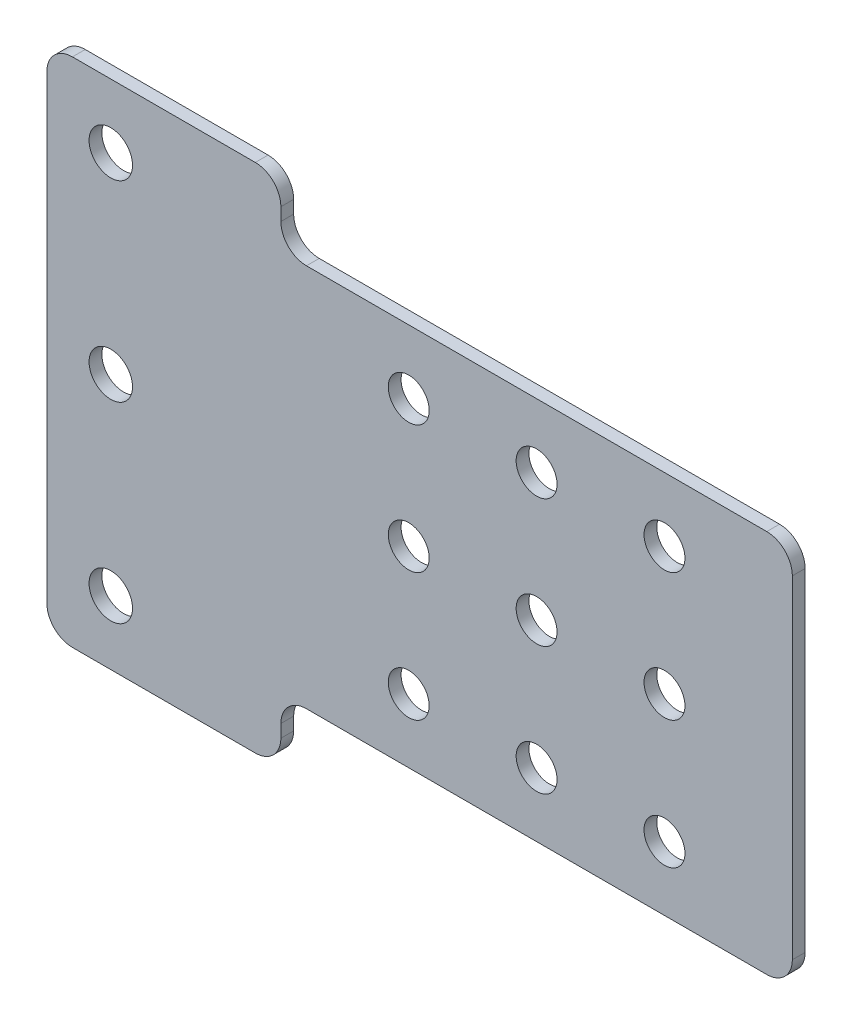
from build123d import *

# Parameters (mm, degrees)
SKETCH1_W           = 50.8
SKETCH1_H           = 38.1
SKETCH1_R           = 2.032
BOSS_EXTRUDE1_DEPTH = 1.27
FILLET3_R           = 2.54
SKETCH2_R           = 2.159
BOSS_EXTRUDE2_DEPTH = 1.27
FILLET6_R           = 2.54


with BuildPart() as part:
    # Sketch1 → Boss-Extrude1 (new body)
    with BuildSketch(Plane.XY):
        Rectangle(SKETCH1_W, SKETCH1_H)
        with Locations((-12.7, 12.7)):
            Circle(SKETCH1_R, mode=Mode.SUBTRACT)
        with Locations((0, 12.7)):
            Circle(SKETCH1_R, mode=Mode.SUBTRACT)
        with Locations((12.7, 12.7)):
            Circle(SKETCH1_R, mode=Mode.SUBTRACT)
        Circle(SKETCH1_R, mode=Mode.SUBTRACT)
        with Locations((12.7, 0)):
            Circle(SKETCH1_R, mode=Mode.SUBTRACT)
        with Locations((0, -12.7)):
            Circle(SKETCH1_R, mode=Mode.SUBTRACT)
        with Locations((12.7, -12.7)):
            Circle(SKETCH1_R, mode=Mode.SUBTRACT)
        with Locations((-12.7, 0)):
            Circle(SKETCH1_R, mode=Mode.SUBTRACT)
        with Locations((-12.7, -12.7)):
            Circle(SKETCH1_R, mode=Mode.SUBTRACT)
    extrude(amount=BOSS_EXTRUDE1_DEPTH)

    # Fillet3
    fillet3_edges = [part.edges().sort_by_distance(p)[0] for p in [
        (25.4, -19.05, 0.635),
        (25.4, 19.05, 0.635),
    ]]
    fillet(fillet3_edges, radius=FILLET3_R)

    # Sketch2 → Boss-Extrude2 (add)
    with BuildSketch(Plane.XY.offset(1.27)):
        Polygon((-25.4, -25.4), (-25.4, -19.05), (-25.4, 19.05), (-25.4, 25.4), (-48.641, 25.4), (-48.641, -25.4), align=None)
        with Locations((-42.291, -19.05)):
            Circle(SKETCH2_R, mode=Mode.SUBTRACT)
        with Locations((-42.291, 0)):
            Circle(SKETCH2_R, mode=Mode.SUBTRACT)
        with Locations((-42.291, 19.05)):
            Circle(SKETCH2_R, mode=Mode.SUBTRACT)
    extrude(amount=-BOSS_EXTRUDE2_DEPTH)

    # Fillet6
    fillet6_edges = [part.edges().sort_by_distance(p)[0] for p in [
        (-25.4, 25.4, 0.635),
        (-25.4, -25.4, 0.635),
        (-48.641, -25.4, 0.635),
        (-48.641, 25.4, 0.635),
        (-25.4, -19.05, 0.635),
        (-25.4, 19.05, 0.635),
    ]]
    fillet(fillet6_edges, radius=FILLET6_R)


solid = part.part
